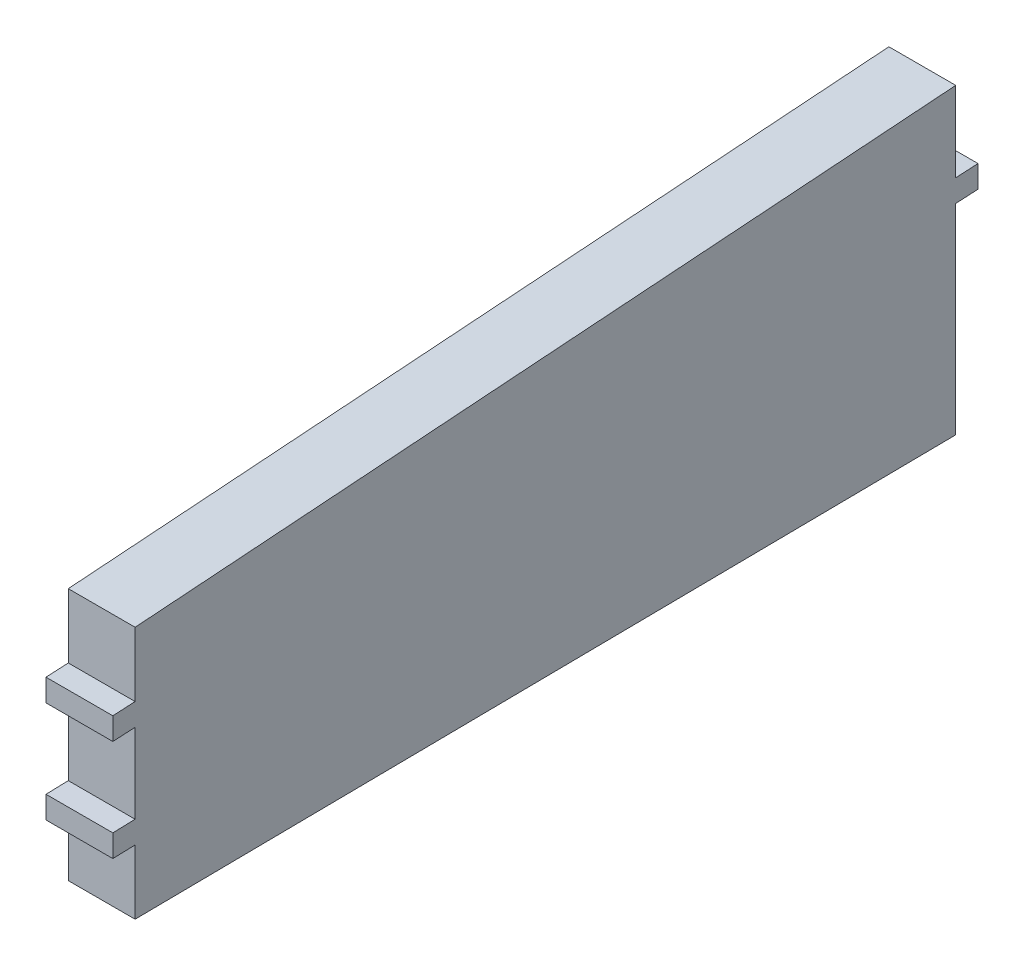
from build123d import *

# Parameters (mm, degrees)
BOSS_EXTRUDE1_DEPTH = 9.525


with BuildPart() as part:
    # Sketch1 → Boss-Extrude1 (new body)
    with BuildSketch(Plane(origin=(243.017706631, 0, 0), x_dir=(0, 0, -1), z_dir=(1, 0, 0))):
        Polygon((-1140.418694078, 370.113593261), (-1140.418694078, 366.938593261), (-1137.243694078, 367.03480398), (-1137.243694078, 357.865105463), (-1020.29786066, 359.174033069), (-1020.29786066, 387.730681963), (-1017.12286066, 387.898272307), (-1017.12286066, 391.073272307), (-1020.29786066, 390.905681963), (-1020.29786066, 402.310214356), (-1137.243694078, 393.902469498), (-1137.243694078, 384.73277098), (-1140.418694078, 384.565180637), (-1140.418694078, 381.390180637), (-1137.243694078, 381.55777098), (-1137.243694078, 370.20980398), align=None)
    extrude(amount=BOSS_EXTRUDE1_DEPTH)


solid = part.part
